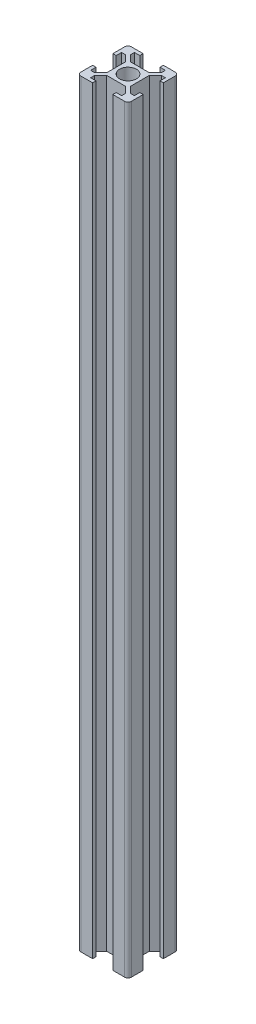
from build123d import *

# Parameters (mm, degrees)
BOSS_EXTRUDE1_DEPTH = 225


with BuildPart() as part:
    # Sketch1 → Boss-Extrude1 (new body)
    with BuildSketch(Plane(origin=(0, 0, 0), x_dir=(1, 0, 0), z_dir=(0, 1, 0))):
        with BuildLine():
            Line((-7.5, -3), (-7.5, -6.5))
            ThreePointArc((-7.5, -6.5), (-7.207106781, -7.207106781), (-6.5, -7.5))
            Line((-6.5, -7.5), (-3, -7.5))
            Line((-3, -7.5), (-3, -6.5))
            Line((-3, -6.5), (-4.6, -6.5))
            Line((-4.6, -6.5), (-4.6, -5.307106781))
            Line((-4.6, -5.307106781), (-2.8, -3.507106781))
            Line((-2.8, -3.507106781), (0, -3.507106781))
            Line((0, -3.507106781), (2.8, -3.507106781))
            Line((2.8, -3.507106781), (4.6, -5.307106781))
            Line((4.6, -5.307106781), (4.6, -6.5))
            Line((4.6, -6.5), (3, -6.5))
            Line((3, -6.5), (3, -7.5))
            Line((3, -7.5), (6.5, -7.5))
            ThreePointArc((6.5, -7.5), (7.207106781, -7.207106781), (7.5, -6.5))
            Line((7.5, -6.5), (7.5, -3))
            Line((7.5, -3), (6.5, -3))
            Line((6.5, -3), (6.5, -4.6))
            Line((6.5, -4.6), (5.307106781, -4.6))
            Line((5.307106781, -4.6), (3.507106781, -2.8))
            Line((3.507106781, -2.8), (3.507106781, 0))
            Line((3.507106781, 0), (3.507106781, 2.8))
            Line((3.507106781, 2.8), (5.307106781, 4.6))
            Line((5.307106781, 4.6), (6.5, 4.6))
            Line((6.5, 4.6), (6.5, 3))
            Line((6.5, 3), (7.5, 3))
            Line((7.5, 3), (7.5, 6.5))
            ThreePointArc((7.5, 6.5), (7.207106781, 7.207106781), (6.5, 7.5))
            Line((6.5, 7.5), (3, 7.5))
            Line((3, 7.5), (3, 6.5))
            Line((3, 6.5), (4.6, 6.5))
            Line((4.6, 6.5), (4.6, 5.307106781))
            Line((4.6, 5.307106781), (2.8, 3.507106781))
            Line((2.8, 3.507106781), (0, 3.507106781))
            Line((0, 3.507106781), (-2.8, 3.507106781))
            Line((-2.8, 3.507106781), (-4.6, 5.307106781))
            Line((-4.6, 5.307106781), (-4.6, 6.5))
            Line((-4.6, 6.5), (-3, 6.5))
            Line((-3, 6.5), (-3, 7.5))
            Line((-3, 7.5), (-6.5, 7.5))
            ThreePointArc((-6.5, 7.5), (-7.207106781, 7.207106781), (-7.5, 6.5))
            Line((-7.5, 6.5), (-7.5, 3))
            Line((-7.5, 3), (-6.5, 3))
            Line((-6.5, 3), (-6.5, 4.6))
            Line((-6.5, 4.6), (-5.307106781, 4.6))
            Line((-5.307106781, 4.6), (-3.507106781, 2.8))
            Line((-3.507106781, 2.8), (-3.507106781, 0))
            Line((-3.507106781, 0), (-3.507106781, -2.8))
            Line((-3.507106781, -2.8), (-5.307106781, -4.6))
            Line((-5.307106781, -4.6), (-6.5, -4.6))
            Line((-6.5, -4.6), (-6.5, -3))
            Line((-6.5, -3), (-7.5, -3))
        make_face()
        with BuildLine():
            ThreePointArc((-2.5, 0), (-1.767766953, -1.767766953), (0, -2.5))
            ThreePointArc((0, -2.5), (1.767766953, -1.767766953), (2.5, 0))
            ThreePointArc((2.5, 0), (1.767766953, 1.767766953), (0, 2.5))
            ThreePointArc((0, 2.5), (-1.767766953, 1.767766953), (-2.5, 0))
        make_face(mode=Mode.SUBTRACT)
    extrude(amount=BOSS_EXTRUDE1_DEPTH)


solid = part.part
